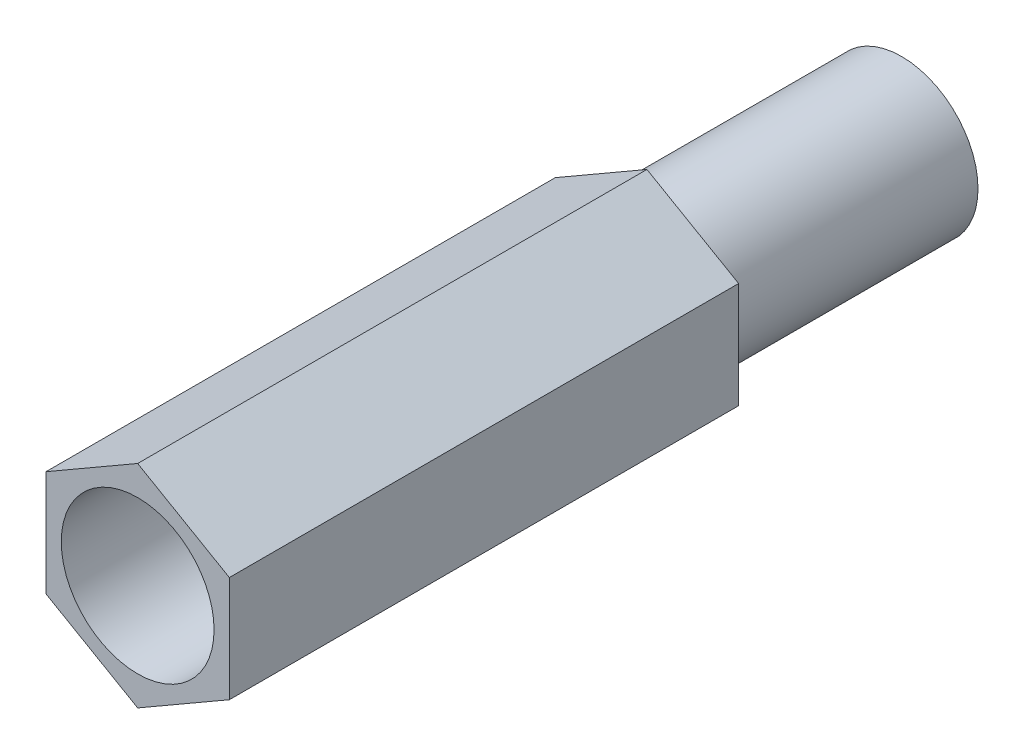
from build123d import *

# Parameters (mm, degrees)
SKETCH_1_R      = 1.5
EXTRUDE_1_DEPTH = 10
SKETCH_2_R      = 1.5
EXTRUDE_2_DEPTH = 5


with BuildPart() as part:
    # 草图1 → 凸台-拉伸1 (new body)
    with BuildSketch(Plane.XY):
        Polygon((0, 2.078460969), (-1.8, 1.039230485), (-1.8, -1.039230485), (0, -2.078460969), (1.8, -1.039230485), (1.8, 1.039230485), align=None)
        Circle(SKETCH_1_R, mode=Mode.SUBTRACT)
    extrude(amount=EXTRUDE_1_DEPTH)

    # 草图2 → 凸台-拉伸2 (add, symmetric)
    with BuildSketch(Plane(origin=(0, 0, 0), x_dir=(-1, 0, 0), z_dir=(0, 0, -1))):
        Circle(SKETCH_2_R)
    extrude(amount=EXTRUDE_2_DEPTH, both=True)


solid = part.part
